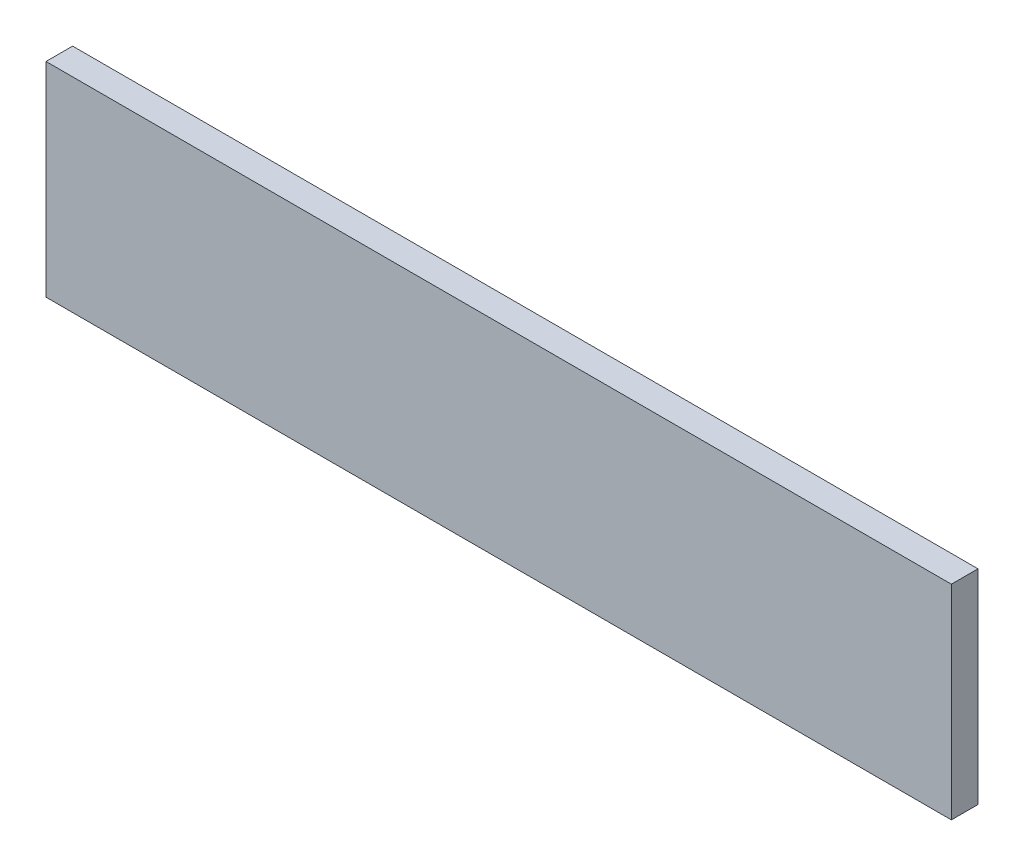
from build123d import *

# Parameters (mm, degrees)
SKETCH2_W           = 647.7
SKETCH2_H           = 146.05
BOSS_EXTRUDE1_DEPTH = 19.05


with BuildPart() as part:
    # Sketch2 → Boss-Extrude1 (new body)
    with BuildSketch(Plane.XY):
        with Locations((323.85, 73.025)):
            Rectangle(SKETCH2_W, SKETCH2_H)
    extrude(amount=BOSS_EXTRUDE1_DEPTH)


solid = part.part
